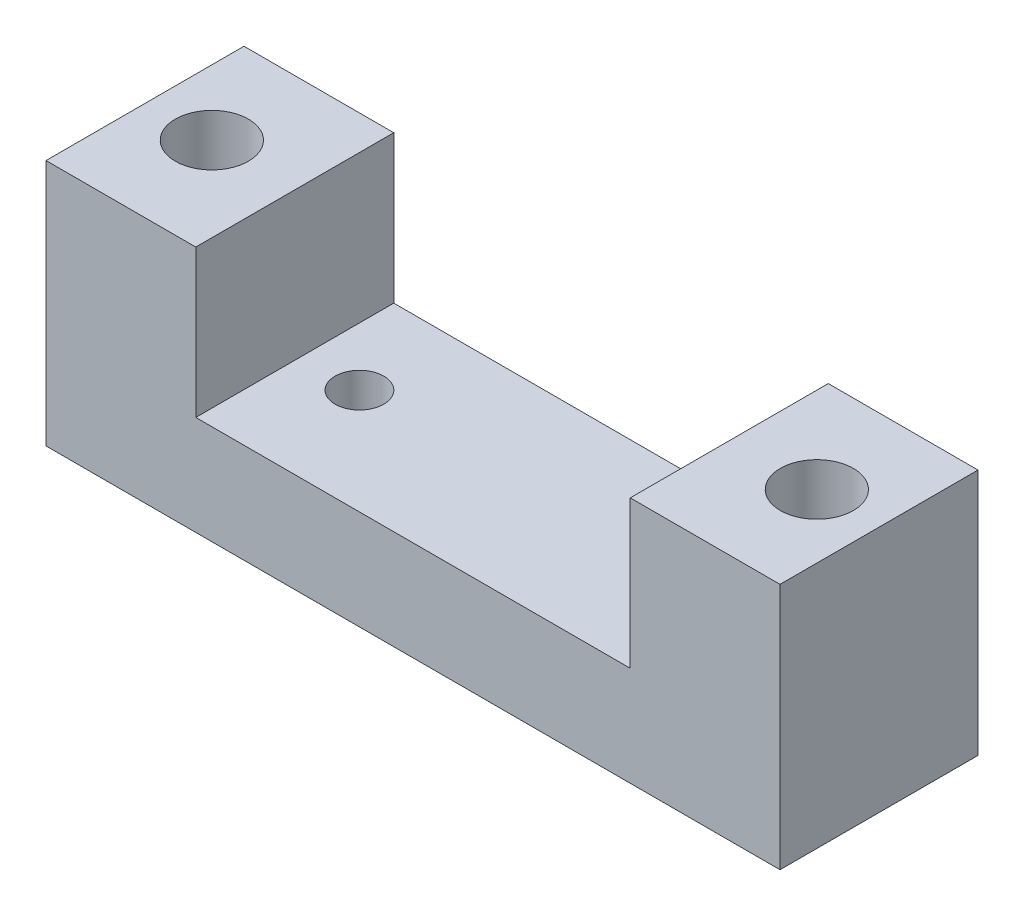
from build123d import *

# Parameters (mm, degrees)
BOSS_EXTRUDE1_DEPTH       = 8.13
F_3_0MM_DOWEL_HOLE1_D     = 3
F_3_0MM_DOWEL_HOLE1_DEPTH = 35
F_3_0MM_DOWEL_HOLE1_TIP   = 0.901290929
F_2_0MM_DOWEL_HOLE1_D     = 2
F_2_0MM_DOWEL_HOLE1_DEPTH = 35
F_2_0MM_DOWEL_HOLE1_TIP   = 0.600860619


with BuildPart() as part:
    # Sketch1 → Boss-Extrude1 (new body)
    with BuildSketch(Plane.XY):
        Polygon((-15.07, 0), (-15.07, 10.15), (-8.92, 10.15), (-8.92, 4.09), (8.92, 4.09), (8.92, 10.15), (15.07, 10.15), (15.07, 0), align=None)
    extrude(amount=BOSS_EXTRUDE1_DEPTH)

    # Ø3.0mm Dowel Hole1
    with Locations(Plane(origin=(0, 10.15, 0), x_dir=(1, 0, 0), z_dir=(0, 1, 0))):
        with Locations((-12.39, -4), (12.452, -4)):
            Hole(F_3_0MM_DOWEL_HOLE1_D / 2, depth=F_3_0MM_DOWEL_HOLE1_DEPTH)
            with Locations((0, 0, -(F_3_0MM_DOWEL_HOLE1_DEPTH + F_3_0MM_DOWEL_HOLE1_TIP / 2))):  # 118° drill point
                Cone(0, F_3_0MM_DOWEL_HOLE1_D / 2, F_3_0MM_DOWEL_HOLE1_TIP, mode=Mode.SUBTRACT)

    # Ø2.0mm Dowel Hole1
    with Locations(Plane(origin=(0, 4.09, 0), x_dir=(1, 0, 0), z_dir=(0, 1, 0))):
        with Locations((-6.53, -3.8), (6.53, -3.8)):
            Hole(F_2_0MM_DOWEL_HOLE1_D / 2, depth=F_2_0MM_DOWEL_HOLE1_DEPTH)
            with Locations((0, 0, -(F_2_0MM_DOWEL_HOLE1_DEPTH + F_2_0MM_DOWEL_HOLE1_TIP / 2))):  # 118° drill point
                Cone(0, F_2_0MM_DOWEL_HOLE1_D / 2, F_2_0MM_DOWEL_HOLE1_TIP, mode=Mode.SUBTRACT)


solid = part.part
